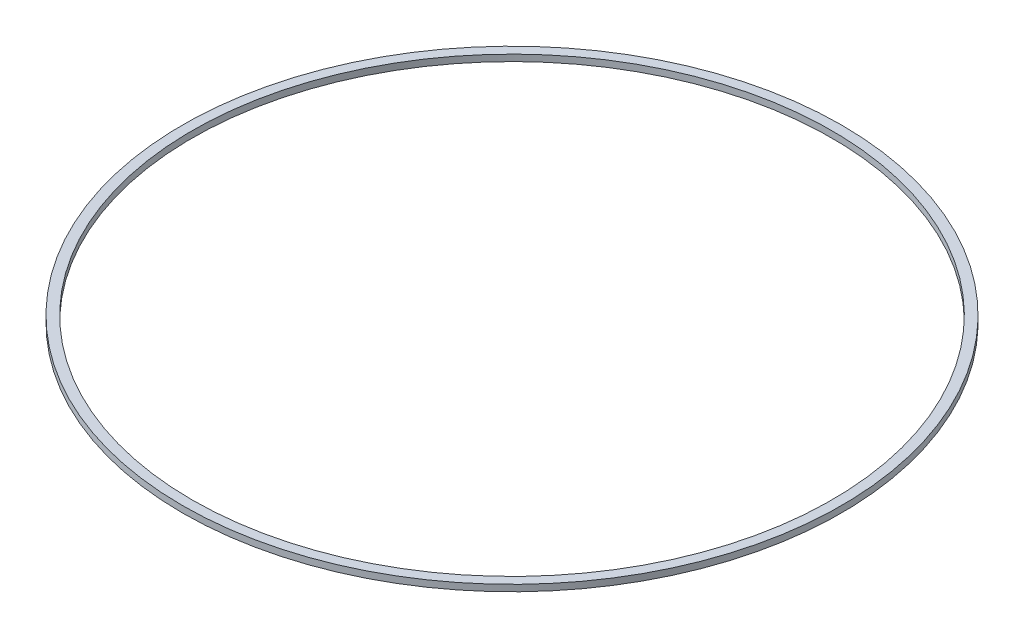
from build123d import *

# Parameters (mm, degrees)
SKETCH1_R           = 101.9
SKETCH1_R_2         = 98.9
BOSS_EXTRUDE1_DEPTH = 2


with BuildPart() as part:
    # Sketch1 → Boss-Extrude1 (new body)
    with BuildSketch(Plane(origin=(0, 0, 0), x_dir=(1, 0, 0), z_dir=(0, 1, 0))):
        with Locations(Location((0, 0, 0), (0, 0, 270))):
            Circle(SKETCH1_R)
        with Locations(Location((0, 0, 0), (0, 0, 270))):
            Circle(SKETCH1_R_2, mode=Mode.SUBTRACT)
    extrude(amount=BOSS_EXTRUDE1_DEPTH)


solid = part.part
